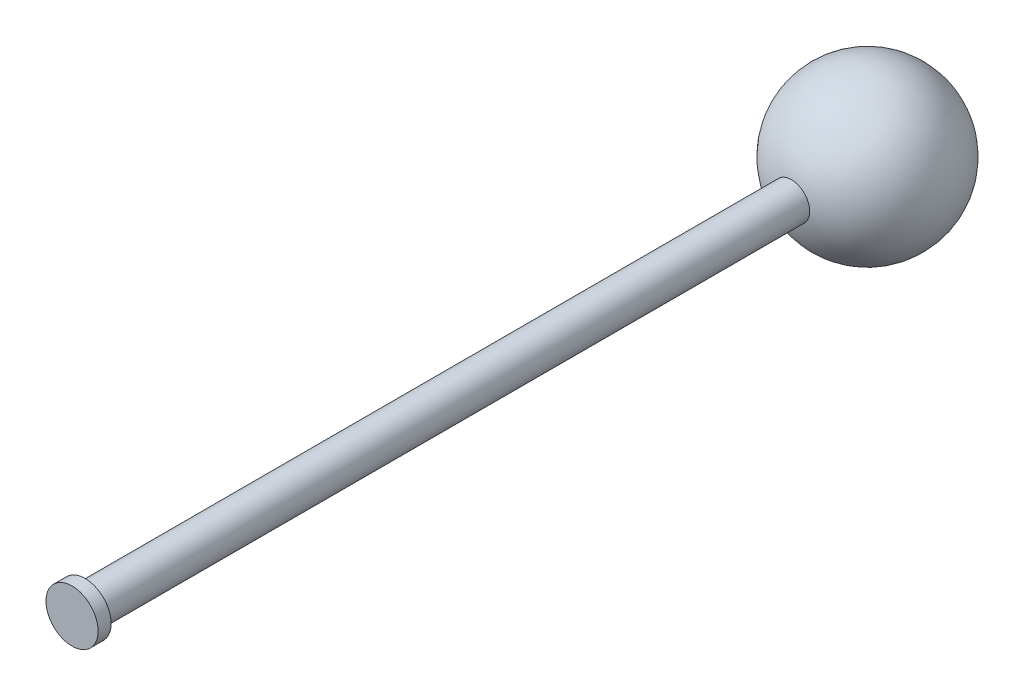
from build123d import *

# Parameters (mm, degrees)
SKETCH2_R           = 0.7
BOSS_EXTRUDE2_DEPTH = 30
SKETCH3_R           = 1
BOSS_EXTRUDE3_DEPTH = 0.5


with BuildPart() as part:
    # Sketch1 → Revolve1 (revolve)
    with BuildSketch(Plane.XY):
        with BuildLine():
            Line((0, 3), (0, -3))
            ThreePointArc((0, -3), (3, 0), (0, 3))
        make_face()
    revolve(axis=Axis((0, 3, 0), (0, -1, 0)))

    # Sketch2 → Boss-Extrude2 (add)
    with BuildSketch(Plane.XY):
        with Locations(Location((0, 0, 0), (0, 0, 180))):
            Circle(SKETCH2_R)
    extrude(amount=BOSS_EXTRUDE2_DEPTH)

    # Sketch3 → Boss-Extrude3 (add)
    with BuildSketch(Plane.XY.offset(30)):
        Circle(SKETCH3_R)
    extrude(amount=BOSS_EXTRUDE3_DEPTH)


solid = part.part
